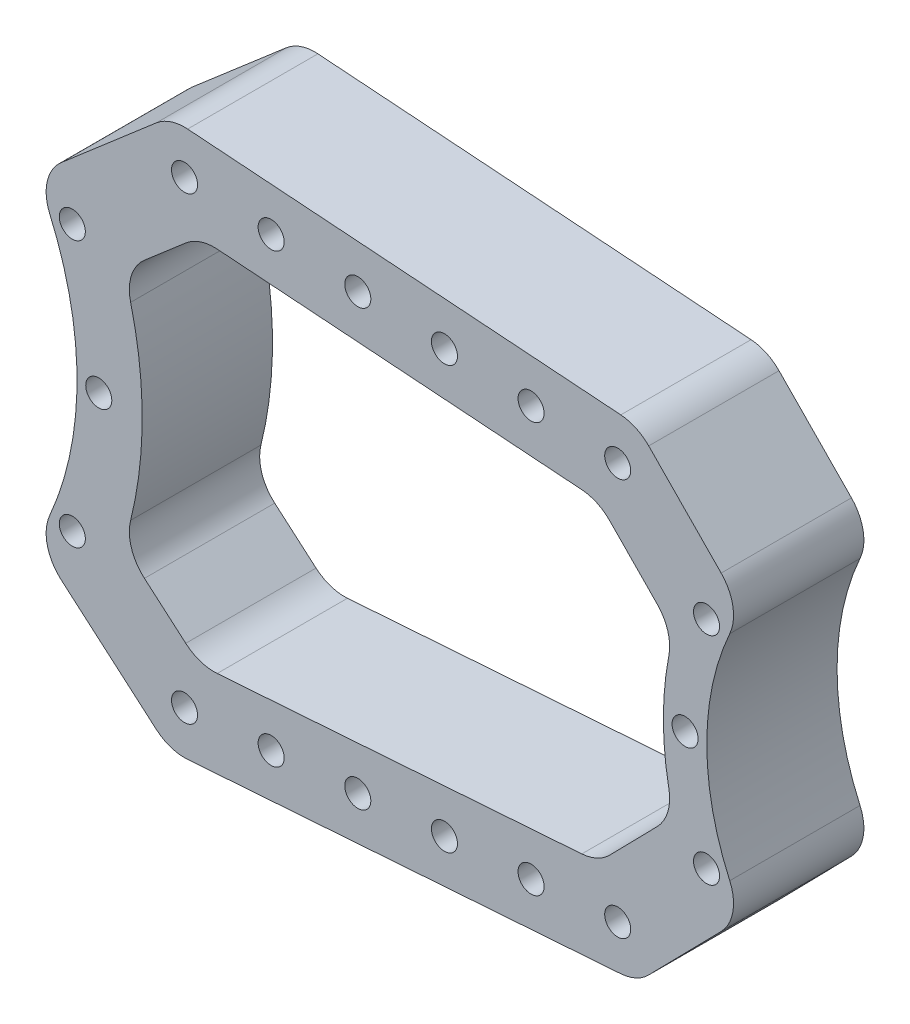
from build123d import *

# Parameters (mm, degrees)
EXTRUDE_1_DEPTH     = 15
FILLET_1_R          = 5
FILLET_2_R          = 5
FILLET_3_R          = 5
FILLET_4_R          = 5
FILLET_5_R          = 5
FILLET_6_R          = 5
FILLET_7_R          = 5
FILLET_8_R          = 5
FILLET_9_R          = 5
FILLET_10_R         = 5
FILLET_11_R         = 5
FILLET_12_R         = 5
FILLET_13_R         = 5
FILLET_14_R         = 5
FILLET_15_R         = 5
FILLET_16_R         = 5
SKETCH_5_R          = 1.5
CUT_EXTRUDE_1_DEPTH = 15


with BuildPart() as part:
    # 草图3 → 凸台-拉伸1 (new body)
    with BuildSketch(Plane.XY):
        with BuildLine():
            Line((101.99145665, -27.727634828), (114.18506552, -15.283623844))
            ThreePointArc((114.18506552, -15.283623844), (110, 0), (114.18506552, 15.283623844))
            Line((114.18506552, 15.283623844), (101.99145665, 27.727634828))
            Line((101.99145665, 27.727634828), (48.171786379, 31.57189699))
            Line((48.171786379, 31.57189699), (32.743622368, 18.278544642))
            ThreePointArc((32.743622368, 18.278544642), (37.5, 0), (32.743622368, -18.278544642))
            Line((32.743622368, -18.278544642), (48.171786379, -31.57189699))
            Line((48.171786379, -31.57189699), (101.99145665, -27.727634828))
        make_face()
        with BuildLine():
            ThreePointArc((42.839131819, -13.777110909), (45, 0), (42.839131819, 13.777110909))
            Line((42.839131819, 13.777110909), (51.574083604, 21.303398011))
            Line((51.574083604, 21.303398011), (97.500283316, 18.022955175))
            Line((97.500283316, 18.022955175), (106.212331228, 9.132000819))
            ThreePointArc((106.212331228, 9.132000819), (105, 0), (106.212331228, -9.132000819))
            Line((106.212331228, -9.132000819), (97.500283316, -18.022955175))
            Line((97.500283316, -18.022955175), (51.574083604, -21.303398011))
            Line((51.574083604, -21.303398011), (42.839131819, -13.777110909))
        make_face(mode=Mode.SUBTRACT)
    extrude(amount=EXTRUDE_1_DEPTH)

    # 圆角1
    fillet_1_edges = [part.edges().sort_by_distance(p)[0] for p in [
        (101.99145665, 27.727634828, 7.5),
    ]]
    fillet(fillet_1_edges, radius=FILLET_1_R)

    # 圆角2
    fillet_2_edges = [part.edges().sort_by_distance(p)[0] for p in [
        (114.18506552, 15.283623844, 7.5),
    ]]
    fillet(fillet_2_edges, radius=FILLET_2_R)

    # 圆角3
    fillet_3_edges = [part.edges().sort_by_distance(p)[0] for p in [
        (114.18506552, -15.283623844, 7.5),
    ]]
    fillet(fillet_3_edges, radius=FILLET_3_R)

    # 圆角4
    fillet_4_edges = [part.edges().sort_by_distance(p)[0] for p in [
        (101.99145665, -27.727634828, 7.5),
    ]]
    fillet(fillet_4_edges, radius=FILLET_4_R)

    # 圆角5
    fillet_5_edges = [part.edges().sort_by_distance(p)[0] for p in [
        (48.171786379, -31.57189699, 7.5),
    ]]
    fillet(fillet_5_edges, radius=FILLET_5_R)

    # 圆角6
    fillet_6_edges = [part.edges().sort_by_distance(p)[0] for p in [
        (48.171786379, 31.57189699, 7.5),
    ]]
    fillet(fillet_6_edges, radius=FILLET_6_R)

    # 圆角7
    fillet_7_edges = [part.edges().sort_by_distance(p)[0] for p in [
        (32.743622368, -18.278544642, 7.5),
    ]]
    fillet(fillet_7_edges, radius=FILLET_7_R)

    # 圆角8
    fillet_8_edges = [part.edges().sort_by_distance(p)[0] for p in [
        (32.743622368, 18.278544642, 7.5),
    ]]
    fillet(fillet_8_edges, radius=FILLET_8_R)

    # 圆角9
    fillet_9_edges = [part.edges().sort_by_distance(p)[0] for p in [
        (97.500283316, -18.022955175, 7.5),
    ]]
    fillet(fillet_9_edges, radius=FILLET_9_R)

    # 圆角10
    fillet_10_edges = [part.edges().sort_by_distance(p)[0] for p in [
        (106.212331228, -9.132000819, 7.5),
    ]]
    fillet(fillet_10_edges, radius=FILLET_10_R)

    # 圆角11
    fillet_11_edges = [part.edges().sort_by_distance(p)[0] for p in [
        (106.212331228, 9.132000819, 7.5),
    ]]
    fillet(fillet_11_edges, radius=FILLET_11_R)

    # 圆角12
    fillet_12_edges = [part.edges().sort_by_distance(p)[0] for p in [
        (97.500283316, 18.022955175, 7.5),
    ]]
    fillet(fillet_12_edges, radius=FILLET_12_R)

    # 圆角13
    fillet_13_edges = [part.edges().sort_by_distance(p)[0] for p in [
        (51.574083604, -21.303398011, 7.5),
    ]]
    fillet(fillet_13_edges, radius=FILLET_13_R)

    # 圆角14
    fillet_14_edges = [part.edges().sort_by_distance(p)[0] for p in [
        (42.839131819, -13.777110909, 7.5),
    ]]
    fillet(fillet_14_edges, radius=FILLET_14_R)

    # 圆角15
    fillet_15_edges = [part.edges().sort_by_distance(p)[0] for p in [
        (42.839131819, 13.777110909, 7.5),
    ]]
    fillet(fillet_15_edges, radius=FILLET_15_R)

    # 圆角16
    fillet_16_edges = [part.edges().sort_by_distance(p)[0] for p in [
        (51.574083604, 21.303398011, 7.5),
    ]]
    fillet(fillet_16_edges, radius=FILLET_16_R)

    # 草图5 → 切除-拉伸1 (cut)
    with BuildSketch(Plane(origin=(0, 0, 0), x_dir=(-1, 0, 0), z_dir=(0, 0, -1))):
        with Locations((-36.9551813, 15.307337295)):
            Circle(SKETCH_5_R)
        with Locations((-40, 0)):
            Circle(SKETCH_5_R)
        with Locations((-36.9551813, -15.307337295)):
            Circle(SKETCH_5_R)
        with Locations((-49.872934992, -26.437647501)):
            Circle(SKETCH_5_R)
        with Locations((-49.872934992, 26.437647501)):
            Circle(SKETCH_5_R)
        with Locations((-99.745869983, 22.875295001)):
            Circle(SKETCH_5_R)
        with Locations((-99.745869983, -22.875295001)):
            Circle(SKETCH_5_R)
        with Locations((-109.973915193, 12.437211552)):
            Circle(SKETCH_5_R)
        with Locations((-107.5, 0)):
            Circle(SKETCH_5_R)
        with Locations((-109.973915193, -12.437211552)):
            Circle(SKETCH_5_R)
        with Locations((-59.84752199, 25.725177001)):
            Circle(SKETCH_5_R)
        with Locations((-69.822108988, 25.012706501)):
            Circle(SKETCH_5_R)
        with Locations((-79.796695986, 24.300236001)):
            Circle(SKETCH_5_R)
        with Locations((-89.771282985, 23.587765501)):
            Circle(SKETCH_5_R)
        with Locations((-89.771282985, -23.587765501)):
            Circle(SKETCH_5_R)
        with Locations((-79.796695986, -24.300236001)):
            Circle(SKETCH_5_R)
        with Locations((-69.822108988, -25.012706501)):
            Circle(SKETCH_5_R)
        with Locations((-59.84752199, -25.725177001)):
            Circle(SKETCH_5_R)
    extrude(amount=-CUT_EXTRUDE_1_DEPTH, mode=Mode.SUBTRACT)


solid = part.part
